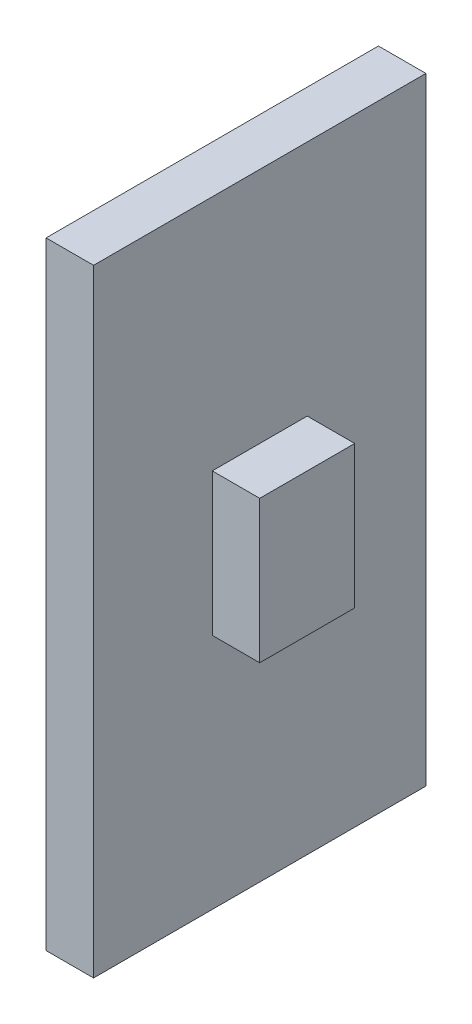
from build123d import *

# Parameters (mm, degrees)
CROQUIS1_W              = 7
CROQUIS1_H              = 13
SALIENTE_EXTRUIR1_DEPTH = 1
CROQUIS2_W              = 2
CROQUIS2_H              = 3
SALIENTE_EXTRUIR2_DEPTH = 1


with BuildPart() as part:
    # Croquis1 → Saliente-Extruir1 (new body)
    with BuildSketch(Plane(origin=(0, 0, 0), x_dir=(0, 0, -1), z_dir=(1, 0, 0))):
        with Locations((0, -1.133333333)):
            Rectangle(CROQUIS1_W, CROQUIS1_H)
    extrude(amount=SALIENTE_EXTRUIR1_DEPTH)


with BuildPart() as body_2:
    # Croquis2 → Saliente-Extruir2 (new body)
    with BuildSketch(Plane(origin=(1, 0, 0), x_dir=(0, 0, -1), z_dir=(1, 0, 0))):
        with Locations((0, -1.133333333)):
            Rectangle(CROQUIS2_W, CROQUIS2_H)
    extrude(amount=SALIENTE_EXTRUIR2_DEPTH)


solid = Compound([part.part, body_2.part])
